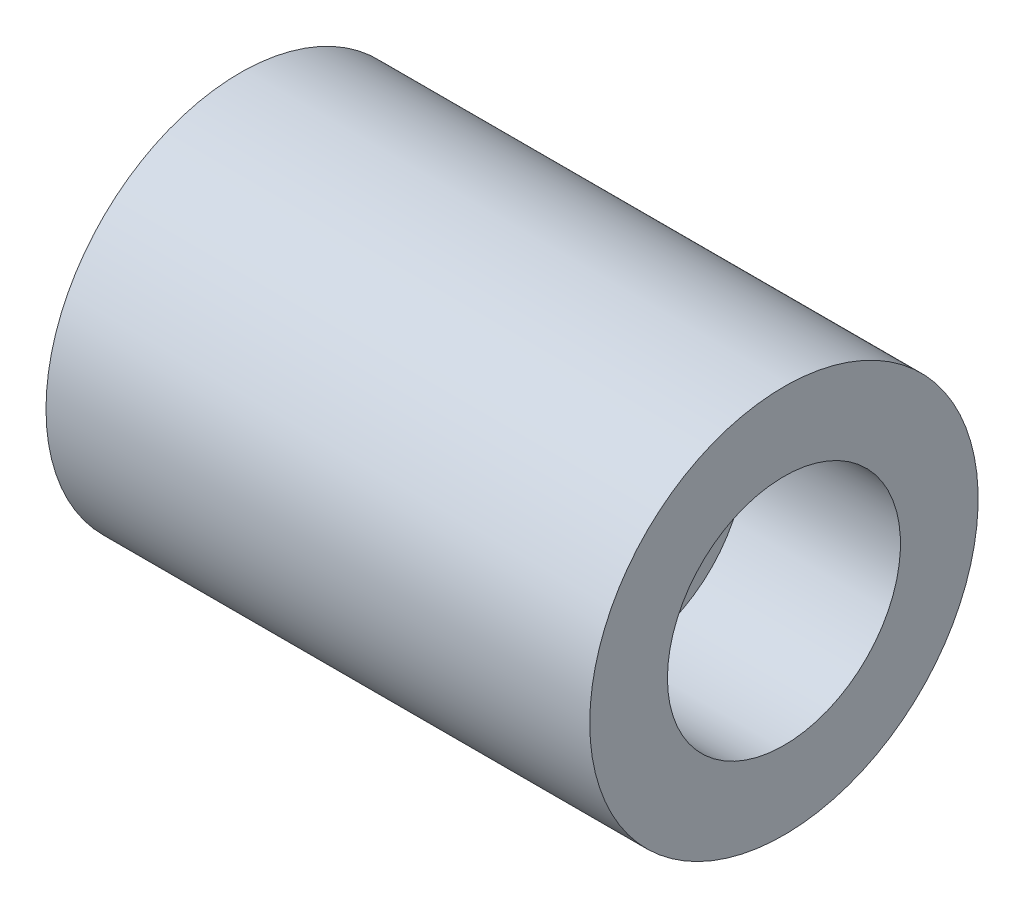
from build123d import *


with BuildPart() as part:
    # 草圖1 → 迴轉1 (revolve)
    with BuildSketch(Plane.XY, mode=Mode.PRIVATE) as revolve_1_sk:
        Polygon((0, 0), (0, 50), (140, 50), (140, 30), (100, 30), (100, 10), (20, 10), (20, 0), align=None)
    revolve(revolve_1_sk.sketch.rotate(Axis((0, 0, 0), (1, 0, 0)), 90), axis=Axis((0, 0, 0), (1, 0, 0)))


solid = part.part
